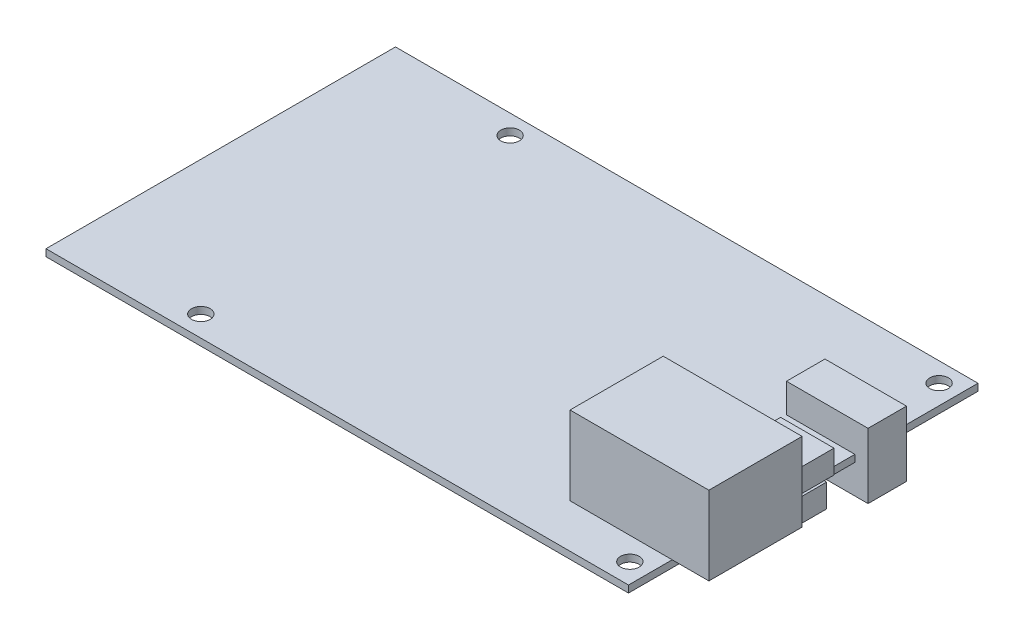
from build123d import *

# Parameters (mm, degrees)
ESQUISSE1_W             = 100
ESQUISSE1_H             = 60
BOSS_EXTRU_1_DEPTH      = 1.2
ESQUISSE2_W             = 21.84
ESQUISSE2_H             = 16
BOSS_EXTRU_2_DEPTH      = 13.5
ESQUISSE3_W             = 9.16
ESQUISSE3_H             = 7.62
BOSS_EXTRU_3_DEPTH      = 4
BOSS_EXTRU_4_DEPTH      = 5
BOSS_EXTRU_4_DEPTH_BACK = 6.2
ESQUISSE4_W             = 14
ESQUISSE4_H             = 6.6
ESQUISSE5_W             = 4.25
ESQUISSE5_H             = 7
BOSS_EXTRU_5_DEPTH      = 4
ENL_V_MAT_EXTRU_1_REACH = 119.398
ESQUISSE6_R             = 1.6
ESQUISSE7_W             = 16
ESQUISSE7_H             = 13.5
BOSS_EXTRU_6_DEPTH      = 2


with BuildPart() as part:
    # Esquisse1 → Boss.-Extru.1 (new body)
    with BuildSketch(Plane(origin=(0, 0, 0), x_dir=(1, 0, 0), z_dir=(0, 1, 0))):
        with Locations((-50, 30)):
            Rectangle(ESQUISSE1_W, ESQUISSE1_H)
    extrude(amount=-BOSS_EXTRU_1_DEPTH)

    # Esquisse2 → Boss.-Extru.2 (add)
    with BuildSketch(Plane(origin=(0, 0, 0), x_dir=(1, 0, 0), z_dir=(0, 1, 0))):
        with Locations((-6.62, 15.5)):
            Rectangle(ESQUISSE2_W, ESQUISSE2_H)
    extrude(amount=BOSS_EXTRU_2_DEPTH)

    # Esquisse3 → Boss.-Extru.3 (add)
    with BuildSketch(Plane(origin=(0, 0, 0), x_dir=(1, 0, 0), z_dir=(0, 1, 0))):
        with Locations((-3.29, 30.18)):
            Rectangle(ESQUISSE3_W, ESQUISSE3_H)
    extrude(amount=BOSS_EXTRU_3_DEPTH)

    # Esquisse4 → Boss.-Extru.4 (add, two sides: drawn at the far end of the back side and taken through both)
    with BuildSketch(Plane(origin=(0, 0, 0), x_dir=(1, 0, 0), z_dir=(0, 1, 0)).offset(-BOSS_EXTRU_4_DEPTH_BACK)):
        with Locations((-4.736, 42.16)):
            Rectangle(ESQUISSE4_W, ESQUISSE4_H)
    extrude(amount=BOSS_EXTRU_4_DEPTH + BOSS_EXTRU_4_DEPTH_BACK)

    # Esquisse5 → Boss.-Extru.5 (add)
    with BuildSketch(Plane.XZ.offset(1.2)):
        with Locations((-1.625, -30.01)):
            Rectangle(ESQUISSE5_W, ESQUISSE5_H)
    extrude(amount=BOSS_EXTRU_5_DEPTH)

    # Esquisse6 → Enlèv. mat.-Extru.1 (cut, up to next)
    with BuildSketch(Plane(origin=(0, 0, 0), x_dir=(1, 0, 0), z_dir=(0, 1, 0)), mode=Mode.PRIVATE) as enl_v_mat_extru_1_sk1:
        with Locations(Location((-77, 56.673, 0), (0, 0, 270))):
            Circle(ESQUISSE6_R)
    enl_v_mat_extru_1_tool1 = extrude(enl_v_mat_extru_1_sk1.sketch, amount=-ENL_V_MAT_EXTRU_1_REACH, mode=Mode.PRIVATE) & part.part
    # Esquisse6 → Enlèv. mat.-Extru.1 (cut, up to next)
    with BuildSketch(Plane(origin=(0, 0, 0), x_dir=(1, 0, 0), z_dir=(0, 1, 0)), mode=Mode.PRIVATE) as enl_v_mat_extru_1_sk2:
        with Locations(Location((-77, 3.581, 0), (0, 0, 270))):
            Circle(ESQUISSE6_R)
    enl_v_mat_extru_1_tool2 = extrude(enl_v_mat_extru_1_sk2.sketch, amount=-ENL_V_MAT_EXTRU_1_REACH, mode=Mode.PRIVATE) & part.part
    # Esquisse6 → Enlèv. mat.-Extru.1 (cut, up to next)
    with BuildSketch(Plane(origin=(0, 0, 0), x_dir=(1, 0, 0), z_dir=(0, 1, 0)), mode=Mode.PRIVATE) as enl_v_mat_extru_1_sk3:
        with Locations(Location((-3.35, 56.673, 0), (0, 0, 270))):
            Circle(ESQUISSE6_R)
    enl_v_mat_extru_1_tool3 = extrude(enl_v_mat_extru_1_sk3.sketch, amount=-ENL_V_MAT_EXTRU_1_REACH, mode=Mode.PRIVATE) & part.part
    # Esquisse6 → Enlèv. mat.-Extru.1 (cut, up to next)
    with BuildSketch(Plane(origin=(0, 0, 0), x_dir=(1, 0, 0), z_dir=(0, 1, 0)), mode=Mode.PRIVATE) as enl_v_mat_extru_1_sk4:
        with Locations(Location((-3.349, 3.581, 0), (0, 0, 270))):
            Circle(ESQUISSE6_R)
    enl_v_mat_extru_1_tool4 = extrude(enl_v_mat_extru_1_sk4.sketch, amount=-ENL_V_MAT_EXTRU_1_REACH, mode=Mode.PRIVATE) & part.part
    add(enl_v_mat_extru_1_tool1.solids().sort_by_distance((-77, 0, -56.673))[0], mode=Mode.SUBTRACT)
    add(enl_v_mat_extru_1_tool2.solids().sort_by_distance((-77, 0, -3.581))[0], mode=Mode.SUBTRACT)
    add(enl_v_mat_extru_1_tool3.solids().sort_by_distance((-3.35, 0, -56.673))[0], mode=Mode.SUBTRACT)
    add(enl_v_mat_extru_1_tool4.solids().sort_by_distance((-3.349, 0, -3.581))[0], mode=Mode.SUBTRACT)

    # Esquisse7 → Boss.-Extru.6 (add)
    with BuildSketch(Plane(origin=(4.3, 0, 0), x_dir=(0, 0, -1), z_dir=(1, 0, 0))):
        with Locations((15.5, 6.75)):
            Rectangle(ESQUISSE7_W, ESQUISSE7_H)
    extrude(amount=BOSS_EXTRU_6_DEPTH)


solid = part.part
